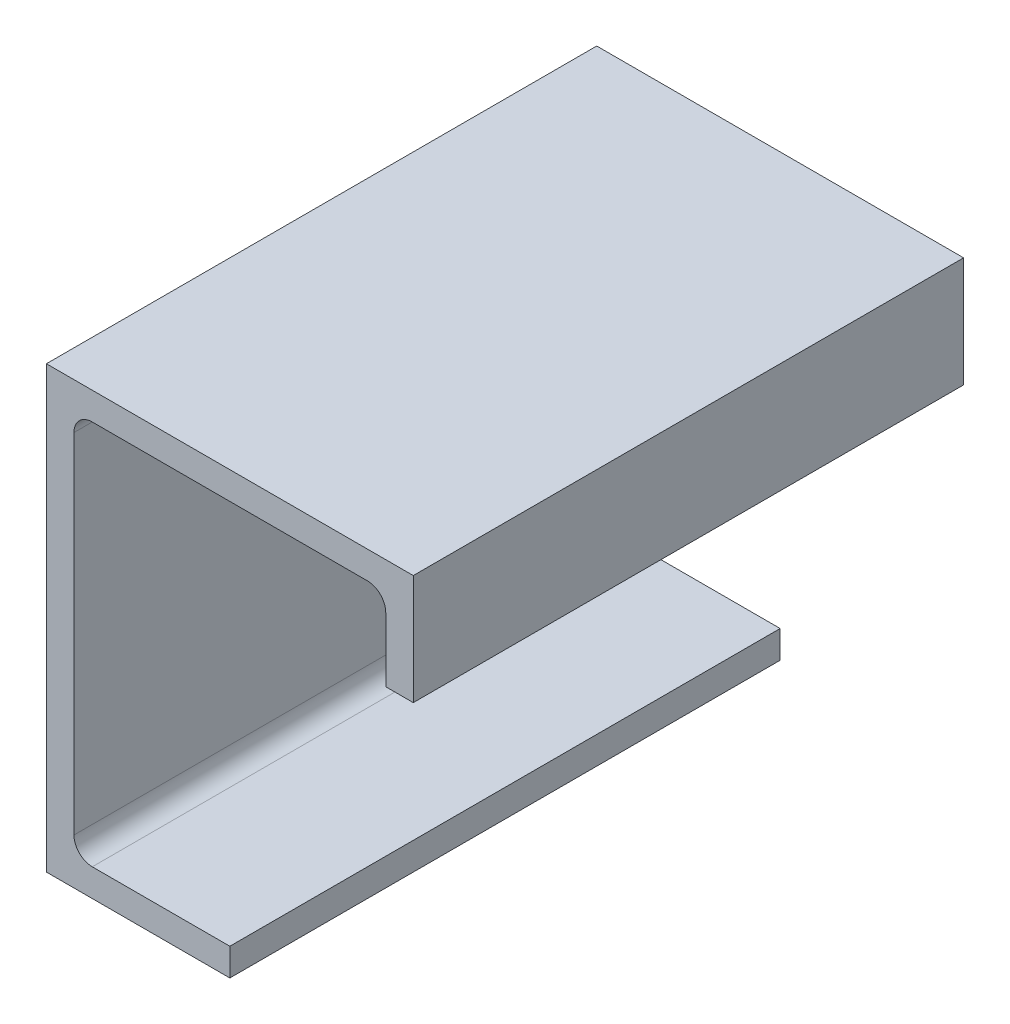
from build123d import *

# Parameters (mm, degrees)
BOSS_EXTRUDE1_DEPTH = 47.625
FILLET1_R           = 3.175
FILLET2_R           = 3.175
FILLET3_R           = 3.175


with BuildPart() as part:
    # Sketch2 → Boss-Extrude1 (new, symmetric)
    with BuildSketch(Plane.XY):
        Polygon((0, 0), (0, 76.2), (63.5, 76.2), (63.5, 57.15), (58.7375, 57.15), (58.7375, 71.4375), (4.7625, 71.4375), (4.7625, 4.7625), (31.75, 4.7625), (31.75, 0), align=None)
    extrude(amount=BOSS_EXTRUDE1_DEPTH, both=True)

    # Fillet1
    fillet1_edges = [part.edges().sort_by_distance(p)[0] for p in [
        (4.7625, 71.4375, 0),
    ]]
    fillet(fillet1_edges, radius=FILLET1_R)

    # Fillet2
    fillet2_edges = [part.edges().sort_by_distance(p)[0] for p in [
        (4.7625, 4.7625, 0),
    ]]
    fillet(fillet2_edges, radius=FILLET2_R)

    # Fillet3
    fillet3_edges = [part.edges().sort_by_distance(p)[0] for p in [
        (58.7375, 71.4375, 0),
    ]]
    fillet(fillet3_edges, radius=FILLET3_R)


solid = part.part
